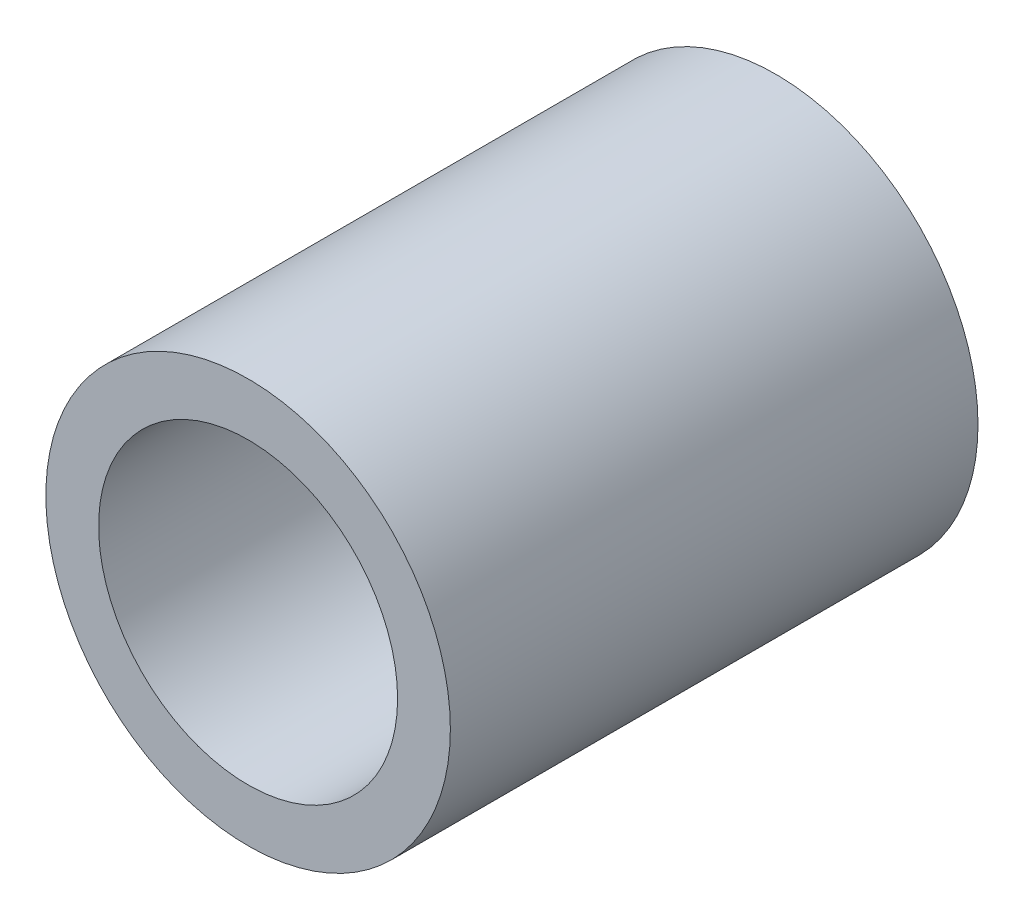
from build123d import *

# Parameters (mm, degrees)
SKETCH_1_R      = 3.45
SKETCH_1_R_2    = 2.55
EXTRUDE_1_DEPTH = 9


with BuildPart() as part:
    # 草图1 → 凸台-拉伸1 (new body)
    with BuildSketch(Plane.XY):
        Circle(SKETCH_1_R)
        Circle(SKETCH_1_R_2, mode=Mode.SUBTRACT)
    extrude(amount=EXTRUDE_1_DEPTH)


solid = part.part
